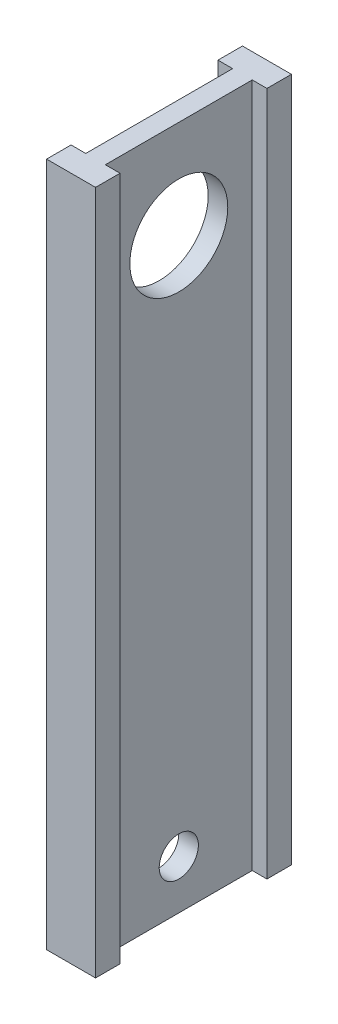
from build123d import *

# Parameters (mm, degrees)
BOSS_EXTRUDE1_DEPTH = 699.106666667
SKETCH2_R           = 50
SKETCH2_R_2         = 20
CUT_EXTRUDE1_DEPTH  = 1000
SCALE1_SCALE        = 0.75


with BuildPart() as part:
    # Sketch1 → Boss-Extrude1 (new body)
    with BuildSketch(Plane(origin=(0, 0, 0), x_dir=(1, 0, 0), z_dir=(0, 1, 0))):
        Polygon((-25, -75), (-25, -100), (25, -100), (25, -75), (10, -75), (10, 75), (25, 75), (25, 100), (-25, 100), (-25, 75), (-10, 75), (-10, -75), align=None)
    extrude(amount=BOSS_EXTRUDE1_DEPTH)

    # Sketch2 → Cut-Extrude1 (cut)
    with BuildSketch(Plane(origin=(10, 0, 0), x_dir=(0, 0, -1), z_dir=(1, 0, 0))):
        with Locations((0, 599.106666667)):
            Circle(SKETCH2_R)
        with Locations((0, 50)):
            Circle(SKETCH2_R_2)
    extrude(amount=-CUT_EXTRUDE1_DEPTH, mode=Mode.SUBTRACT)


with BuildPart() as part_1:
    # Scale1: scaled about (0, 340.906804135, 0)
    add(part.part.scale(SCALE1_SCALE).moved(Location((0, 85.226701034, 0))))


solid = part_1.part
